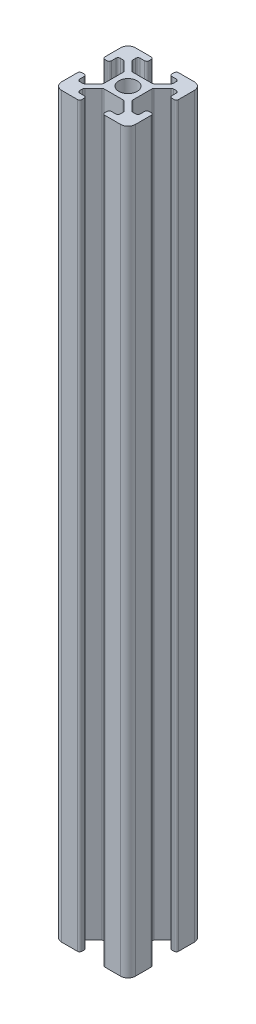
from build123d import *

# Parameters (mm, degrees)
SKETCH_1_R      = 2.5
EXTRUDE_1_DEPTH = 200


with BuildPart() as part:
    # 草图1 → 凸台-拉伸1 (new body)
    with BuildSketch(Plane(origin=(0, 0, 0), x_dir=(1, 0, 0), z_dir=(0, 1, 0))):
        with BuildLine():
            Line((3.1, 8.8), (3.1, 9.4))
            ThreePointArc((3.1, 9.4), (3.275735931, 9.824264069), (3.7, 10))
            Line((3.7, 10), (8, 10))
            ThreePointArc((8, 10), (9.414213562, 9.414213562), (10, 8))
            Line((10, 8), (10, 3.7))
            ThreePointArc((10, 3.7), (9.824264069, 3.275735931), (9.4, 3.1))
            Line((9.4, 3.1), (8.8, 3.1))
            ThreePointArc((8.8, 3.1), (8.375735931, 3.275735931), (8.2, 3.7))
            Line((8.2, 3.7), (8.2, 4.9))
            ThreePointArc((8.2, 4.9), (8.024264069, 5.324264069), (7.6, 5.5))
            Line((7.6, 5.5), (6.809188309, 5.5))
            ThreePointArc((6.809188309, 5.5), (6.57957825, 5.45432772), (6.38492424, 5.324264069))
            Line((6.38492424, 5.324264069), (4.075735931, 3.01507576))
            ThreePointArc((4.075735931, 3.01507576), (3.94567228, 2.82042175), (3.9, 2.590811691))
            Line((3.9, 2.590811691), (3.9, 0))
            Line((3.9, 0), (3.9, -2.590811691))
            ThreePointArc((3.9, -2.590811691), (3.94567228, -2.82042175), (4.075735931, -3.01507576))
            Line((4.075735931, -3.01507576), (6.38492424, -5.324264069))
            ThreePointArc((6.38492424, -5.324264069), (6.57957825, -5.45432772), (6.809188309, -5.5))
            Line((6.809188309, -5.5), (7.6, -5.5))
            ThreePointArc((7.6, -5.5), (8.024264069, -5.324264069), (8.2, -4.9))
            Line((8.2, -4.9), (8.2, -3.7))
            ThreePointArc((8.2, -3.7), (8.375735931, -3.275735931), (8.8, -3.1))
            Line((8.8, -3.1), (9.4, -3.1))
            ThreePointArc((9.4, -3.1), (9.824264069, -3.275735931), (10, -3.7))
            Line((10, -3.7), (10, -8))
            ThreePointArc((10, -8), (9.414213562, -9.414213562), (8, -10))
            Line((8, -10), (3.7, -10))
            ThreePointArc((3.7, -10), (3.275735931, -9.824264069), (3.1, -9.4))
            Line((3.1, -9.4), (3.1, -8.8))
            ThreePointArc((3.1, -8.8), (3.275735931, -8.375735931), (3.7, -8.2))
            Line((3.7, -8.2), (4.9, -8.2))
            ThreePointArc((4.9, -8.2), (5.324264069, -8.024264069), (5.5, -7.6))
            Line((5.5, -7.6), (5.5, -6.809188309))
            ThreePointArc((5.5, -6.809188309), (5.45432772, -6.57957825), (5.324264069, -6.38492424))
            Line((5.324264069, -6.38492424), (3.01507576, -4.075735931))
            ThreePointArc((3.01507576, -4.075735931), (2.82042175, -3.94567228), (2.590811691, -3.9))
            Line((2.590811691, -3.9), (0, -3.9))
            Line((0, -3.9), (-2.590811691, -3.9))
            ThreePointArc((-2.590811691, -3.9), (-2.82042175, -3.94567228), (-3.01507576, -4.075735931))
            Line((-3.01507576, -4.075735931), (-5.324264069, -6.38492424))
            ThreePointArc((-5.324264069, -6.38492424), (-5.45432772, -6.57957825), (-5.5, -6.809188309))
            Line((-5.5, -6.809188309), (-5.5, -7.6))
            ThreePointArc((-5.5, -7.6), (-5.324264069, -8.024264069), (-4.9, -8.2))
            Line((-4.9, -8.2), (-3.7, -8.2))
            ThreePointArc((-3.7, -8.2), (-3.275735931, -8.375735931), (-3.1, -8.8))
            Line((-3.1, -8.8), (-3.1, -9.4))
            ThreePointArc((-3.1, -9.4), (-3.275735931, -9.824264069), (-3.7, -10))
            Line((-3.7, -10), (-8, -10))
            ThreePointArc((-8, -10), (-9.414213562, -9.414213562), (-10, -8))
            Line((-10, -8), (-10, -3.7))
            ThreePointArc((-10, -3.7), (-9.824264069, -3.275735931), (-9.4, -3.1))
            Line((-9.4, -3.1), (-8.8, -3.1))
            ThreePointArc((-8.8, -3.1), (-8.375735931, -3.275735931), (-8.2, -3.7))
            Line((-8.2, -3.7), (-8.2, -4.9))
            ThreePointArc((-8.2, -4.9), (-8.024264069, -5.324264069), (-7.6, -5.5))
            Line((-7.6, -5.5), (-6.809188309, -5.5))
            ThreePointArc((-6.809188309, -5.5), (-6.57957825, -5.45432772), (-6.38492424, -5.324264069))
            Line((-6.38492424, -5.324264069), (-4.075735931, -3.01507576))
            ThreePointArc((-4.075735931, -3.01507576), (-3.94567228, -2.82042175), (-3.9, -2.590811691))
            Line((-3.9, -2.590811691), (-3.9, 0))
            Line((-3.9, 0), (-3.9, 2.590811691))
            ThreePointArc((-3.9, 2.590811691), (-3.94567228, 2.82042175), (-4.075735931, 3.01507576))
            Line((-4.075735931, 3.01507576), (-6.38492424, 5.324264069))
            ThreePointArc((-6.38492424, 5.324264069), (-6.57957825, 5.45432772), (-6.809188309, 5.5))
            Line((-6.809188309, 5.5), (-7.6, 5.5))
            ThreePointArc((-7.6, 5.5), (-8.024264069, 5.324264069), (-8.2, 4.9))
            Line((-8.2, 4.9), (-8.2, 3.7))
            ThreePointArc((-8.2, 3.7), (-8.375735931, 3.275735931), (-8.8, 3.1))
            Line((-8.8, 3.1), (-9.4, 3.1))
            ThreePointArc((-9.4, 3.1), (-9.824264069, 3.275735931), (-10, 3.7))
            Line((-10, 3.7), (-10, 8))
            ThreePointArc((-10, 8), (-9.414213562, 9.414213562), (-8, 10))
            Line((-8, 10), (-3.7, 10))
            ThreePointArc((-3.7, 10), (-3.275735931, 9.824264069), (-3.1, 9.4))
            Line((-3.1, 9.4), (-3.1, 8.8))
            ThreePointArc((-3.1, 8.8), (-3.275735931, 8.375735931), (-3.7, 8.2))
            Line((-3.7, 8.2), (-4.9, 8.2))
            ThreePointArc((-4.9, 8.2), (-5.324264069, 8.024264069), (-5.5, 7.6))
            Line((-5.5, 7.6), (-5.5, 6.809188309))
            ThreePointArc((-5.5, 6.809188309), (-5.45432772, 6.57957825), (-5.324264069, 6.38492424))
            Line((-5.324264069, 6.38492424), (-3.01507576, 4.075735931))
            ThreePointArc((-3.01507576, 4.075735931), (-2.82042175, 3.94567228), (-2.590811691, 3.9))
            Line((-2.590811691, 3.9), (0, 3.9))
            Line((0, 3.9), (2.590811691, 3.9))
            ThreePointArc((2.590811691, 3.9), (2.82042175, 3.94567228), (3.01507576, 4.075735931))
            Line((3.01507576, 4.075735931), (5.324264069, 6.38492424))
            ThreePointArc((5.324264069, 6.38492424), (5.45432772, 6.57957825), (5.5, 6.809188309))
            Line((5.5, 6.809188309), (5.5, 7.6))
            ThreePointArc((5.5, 7.6), (5.324264069, 8.024264069), (4.9, 8.2))
            Line((4.9, 8.2), (3.7, 8.2))
            ThreePointArc((3.7, 8.2), (3.275735931, 8.375735931), (3.1, 8.8))
        make_face()
        with Locations(Location((0, 0, 0), (0, 0, 270))):
            Circle(SKETCH_1_R, mode=Mode.SUBTRACT)
    extrude(amount=EXTRUDE_1_DEPTH)


solid = part.part
